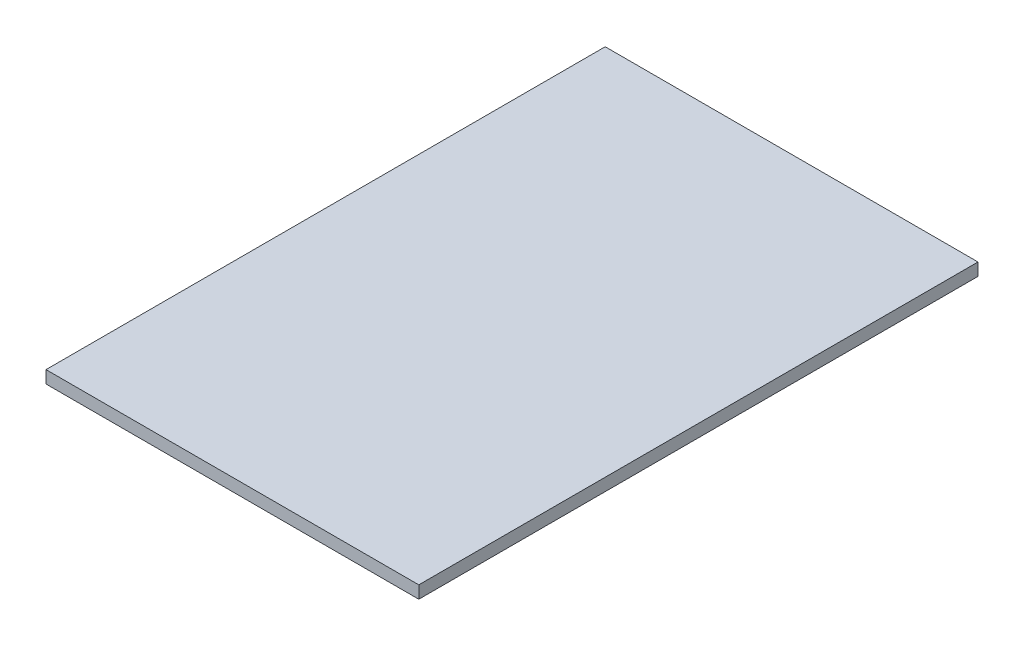
from build123d import *

# Parameters (mm, degrees)
SKETCH1_W           = 200
SKETCH1_H           = 300
BOSS_EXTRUDE1_DEPTH = 6.7


with BuildPart() as part:
    # Sketch1 → Boss-Extrude1 (new body)
    with BuildSketch(Plane(origin=(0, 0, 0), x_dir=(1, 0, 0), z_dir=(0, 1, 0))):
        with Locations((100, 150)):
            Rectangle(SKETCH1_W, SKETCH1_H)
    extrude(amount=BOSS_EXTRUDE1_DEPTH)


solid = part.part
